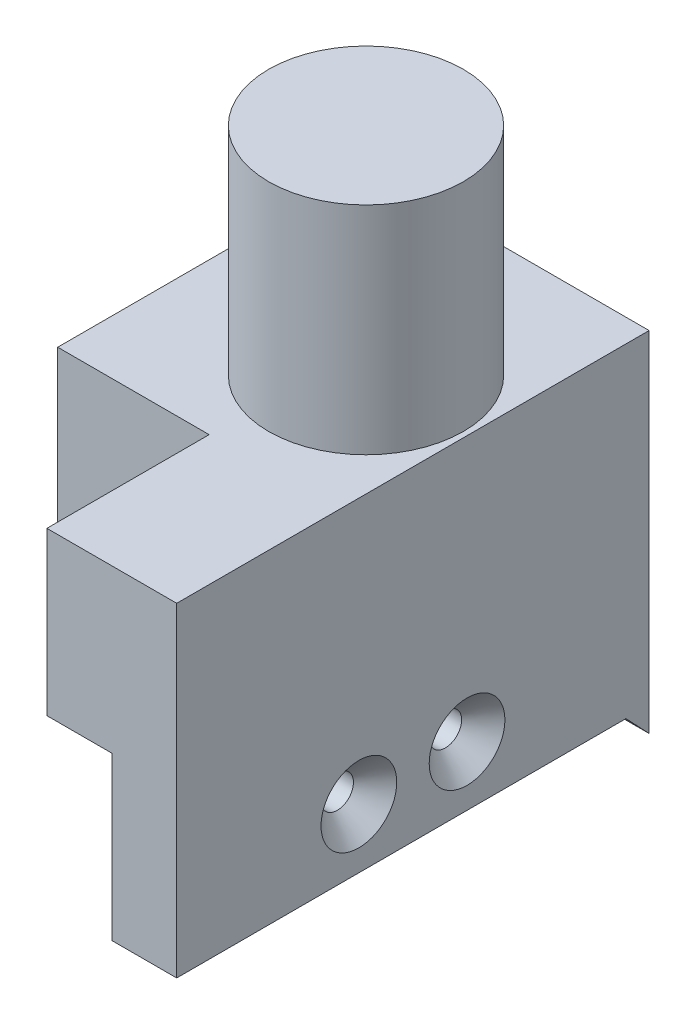
from build123d import *

# Parameters (mm, degrees)
SKETCH_1_R          = 9
EXTRUDE_1_DEPTH     = 20
SKETCH_2_W          = 20
SKETCH_2_H          = 43.67
EXTRUDE_2_DEPTH     = 15
SKETCH_3_W          = 14
SKETCH_3_H          = 15
CUT_EXTRUDE_1_DEPTH = 38.433273968
SKETCH_4_W          = 20
SKETCH_4_H          = 4
EXTRUDE_3_DEPTH     = 17.26
CUT_EXTRUDE_2_DEPTH = 50.193064552
EXTRUDE_4_DEPTH     = 30
SKETCH_7_R          = 1.5
CUT_EXTRUDE_3_DEPTH = 50.454095887
EXTRUDE_5_DEPTH     = 6
CHAMFER_1_SIZE      = 2


with BuildPart() as part:
    # Эскиз1 → Бобышка-Вытянуть1 (new body)
    with BuildSketch(Plane(origin=(0, 0, 0), x_dir=(1, 0, 0), z_dir=(0, 1, 0))):
        with Locations(Location((0, 0, 0), (0, 0, 270))):
            Circle(SKETCH_1_R)
    extrude(amount=EXTRUDE_1_DEPTH)

    # Эскиз2 → Бобышка-Вытянуть2 (add)
    with BuildSketch(Plane.XZ):
        with Locations((-6.5, 5.165)):
            Rectangle(SKETCH_2_W, SKETCH_2_H)
    extrude(amount=EXTRUDE_2_DEPTH)

    # Эскиз3 → Вырез-Вытянуть1 (cut, through all)
    with BuildSketch(Plane(origin=(0, 0, 0), x_dir=(1, 0, 0), z_dir=(0, 1, 0))):
        with Locations((-9.5, -19.5)):
            Rectangle(SKETCH_3_W, SKETCH_3_H)
    extrude(amount=-CUT_EXTRUDE_1_DEPTH, mode=Mode.SUBTRACT)

    # Эскиз4 → Бобышка-Вытянуть3 (add)
    with BuildSketch(Plane.XZ.offset(15)):
        with Locations((-6.5, -14.67)):
            Rectangle(SKETCH_4_W, SKETCH_4_H)
    extrude(amount=EXTRUDE_3_DEPTH)

    # Эскиз5 → Вырез-Вытянуть2 (cut, through all)
    with BuildSketch(Plane.ZY.offset(16.5)):
        Polygon((-12.67, -32.26), (-12.67, -28.031597138), (-16.67, -32.26), align=None)
    extrude(amount=-CUT_EXTRUDE_2_DEPTH, mode=Mode.SUBTRACT)

    # Эскиз6 → Бобышка-Вытянуть4 (add)
    with BuildSketch(Plane.XZ):
        Polygon((3.5, 8.291561976), (3.5, 27), (9.5, 27), (9.5, -16.67), (3.5, -16.67), (3.5, -8.291561976), align=None)
    extrude(amount=EXTRUDE_4_DEPTH)

    # Эскиз7 → Вырез-Вытянуть3 (cut, through all)
    with BuildSketch(Plane(origin=(9.5, 0, 0), x_dir=(0, 0, -1), z_dir=(1, 0, 0))):
        with Locations((-10.16, -24.5)):
            Circle(SKETCH_7_R)
        with Locations((-0.16, -24.5)):
            Circle(SKETCH_7_R)
    extrude(amount=-CUT_EXTRUDE_3_DEPTH, mode=Mode.SUBTRACT)

    # Эскиз8 → Бобышка-Вытянуть5 (add)
    with BuildSketch(Plane(origin=(3.5, 0, 0), x_dir=(0, 0, -1), z_dir=(1, 0, 0))):
        Polygon((16.67, -30), (14.532076937, -30), (16.67, -32.26), align=None)
    extrude(amount=EXTRUDE_5_DEPTH)

    # Фаска1
    chamfer_1_edges = [part.edges().sort_by_distance(p)[0] for p in [
        (9.5, -24.5, 11.66),
        (9.5, -24.5, 1.66),
    ]]
    chamfer(chamfer_1_edges, length=CHAMFER_1_SIZE)


solid = part.part
